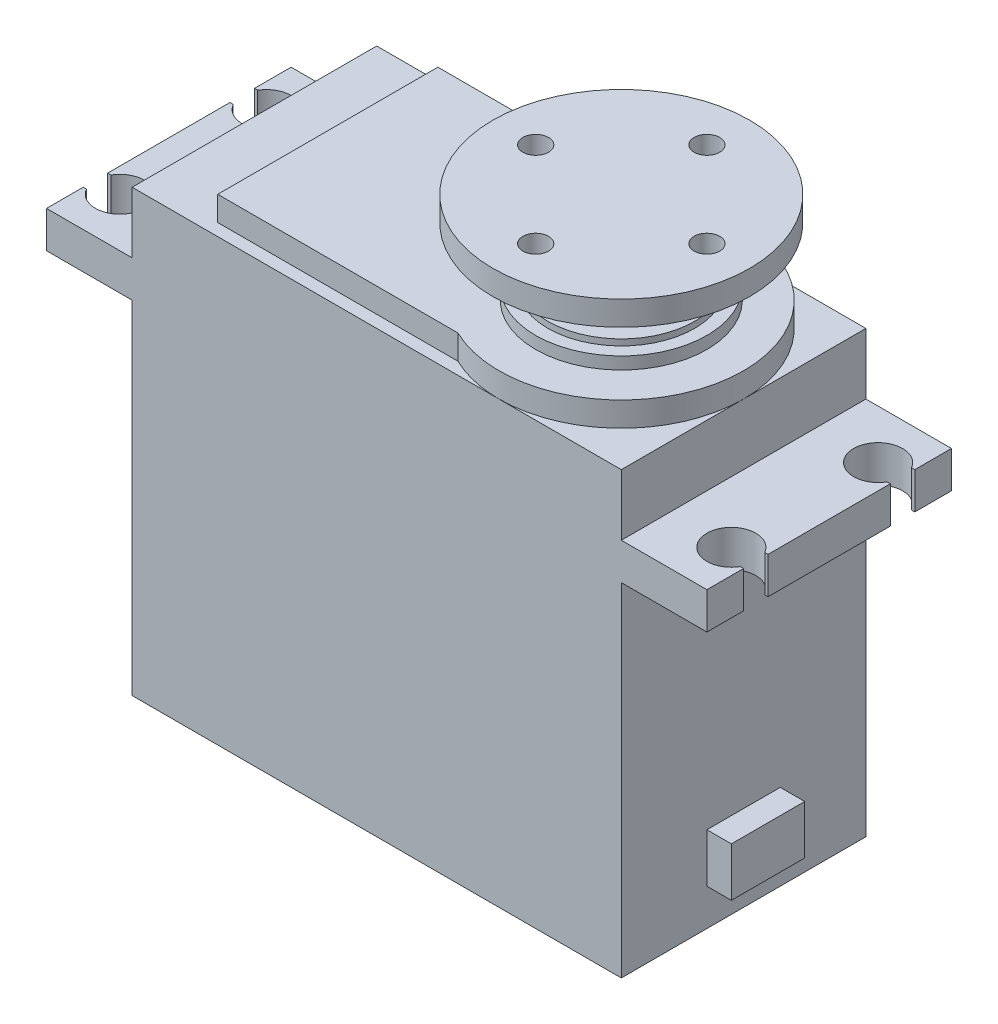
from build123d import *

# Parameters (mm, degrees)
SKETCH1_W           = 40
SKETCH1_H           = 36
BOSS_EXTRUDE1_DEPTH = 20
BOSS_EXTRUDE3_DEPTH = 2
SKETCH4_R           = 7
BOSS_EXTRUDE4_DEPTH = 1
SKETCH5_R           = 6
BOSS_EXTRUDE5_DEPTH = 0.5
SKETCH8_R           = 4.5
BOSS_EXTRUDE6_DEPTH = 4
SKETCH9_R           = 10.5
BOSS_EXTRUDE7_DEPTH = 2
SKETCH13_W          = 7
SKETCH13_H          = 3
BOSS_EXTRUDE8_DEPTH = 20
CUT_EXTRUDE1_DEPTH  = 3
SKETCH17_W          = 6
SKETCH17_H          = 4
BOSS_EXTRUDE9_DEPTH = 2
SKETCH19_R          = 1.05
CUT_EXTRUDE2_DEPTH  = 2


with BuildPart() as part:
    # Sketch1 → Boss-Extrude1 (new body)
    with BuildSketch(Plane.XY):
        Rectangle(SKETCH1_W, SKETCH1_H)
    extrude(amount=BOSS_EXTRUDE1_DEPTH)

    # Sketch2 → Boss-Extrude3 (add)
    with BuildSketch(Plane(origin=(0, 18, 0), x_dir=(1, 0, 0), z_dir=(0, 1, 0))):
        with BuildLine():
            Line((-14, -1), (5.641101056, -1))
            ThreePointArc((5.641101056, -1), (20, -10), (5.641101056, -19))
            Line((5.641101056, -19), (-14, -19))
            Line((-14, -19), (-14, -1))
        make_face()
    extrude(amount=BOSS_EXTRUDE3_DEPTH)

    # Sketch4 → Boss-Extrude4 (add)
    with BuildSketch(Plane(origin=(0, 20, 0), x_dir=(1, 0, 0), z_dir=(0, 1, 0))):
        with Locations(Location((10, -10, 0), (0, 0, 270))):
            Circle(SKETCH4_R)
    extrude(amount=BOSS_EXTRUDE4_DEPTH)

    # Sketch5 → Boss-Extrude5 (add)
    with BuildSketch(Plane(origin=(0, 21, 0), x_dir=(1, 0, 0), z_dir=(0, 1, 0))):
        with Locations(Location((10, -10, 0), (0, 0, 270))):
            Circle(SKETCH5_R)
    extrude(amount=BOSS_EXTRUDE5_DEPTH)

    # Sketch8 → Boss-Extrude6 (add)
    with BuildSketch(Plane(origin=(0, 21.5, 0), x_dir=(1, 0, 0), z_dir=(0, 1, 0))):
        with Locations(Location((10, -10, 0), (0, 0, 270))):
            Circle(SKETCH8_R)
    extrude(amount=BOSS_EXTRUDE6_DEPTH)

    # Sketch9 → Boss-Extrude7 (add)
    with BuildSketch(Plane(origin=(0, 25.5, 0), x_dir=(1, 0, 0), z_dir=(0, 1, 0))):
        with Locations(Location((10, -10, 0), (0, 0, 270))):
            Circle(SKETCH9_R)
    extrude(amount=BOSS_EXTRUDE7_DEPTH)

    # Sketch13 → Boss-Extrude8 (add)
    with BuildSketch(Plane(origin=(0, 0, 0), x_dir=(-1, 0, 0), z_dir=(0, 0, -1))):
        with Locations((23.5, 11.5)):
            Rectangle(SKETCH13_W, SKETCH13_H)
        with Locations((-23.5, 11.5)):
            Rectangle(SKETCH13_W, SKETCH13_H)
    extrude(amount=-BOSS_EXTRUDE8_DEPTH)

    # Sketch14 → Cut-Extrude1 (cut)
    with BuildSketch(Plane(origin=(0, 13, 0), x_dir=(1, 0, 0), z_dir=(0, 1, 0))):
        with BuildLine():
            Line((-27, -17), (-27, -15))
            Line((-27, -15), (-26.732050808, -15))
            ThreePointArc((-26.732050808, -15), (-23, -16), (-26.732050808, -17))
            Line((-26.732050808, -17), (-27, -17))
        make_face()
        with BuildLine():
            Line((-27, -3), (-26.732050808, -3))
            ThreePointArc((-26.732050808, -3), (-23, -4), (-26.732050808, -5))
            Line((-26.732050808, -5), (-27, -5))
            Line((-27, -5), (-27, -3))
        make_face()
    cut_extrude1 = extrude(amount=-CUT_EXTRUDE1_DEPTH, mode=Mode.SUBTRACT)

    # Mirror2: Cut-Extrude1 across plane
    add(cut_extrude1.mirror(Plane(origin=(0, 0, 0), x_dir=(0, 0, 1), z_dir=(1, 0, 0))), mode=Mode.SUBTRACT)

    # Sketch17 → Boss-Extrude9 (add)
    with BuildSketch(Plane(origin=(20, 0, 0), x_dir=(0, 0, -1), z_dir=(1, 0, 0))):
        with Locations((-10, -13)):
            Rectangle(SKETCH17_W, SKETCH17_H)
    extrude(amount=BOSS_EXTRUDE9_DEPTH)

    # Sketch19 → Cut-Extrude2 (cut)
    with BuildSketch(Plane(origin=(0, 27.5, 0), x_dir=(1, 0, 0), z_dir=(0, 1, 0))):
        with Locations(Location((10, -3, 0), (0, 0, 270))):
            Circle(SKETCH19_R)
        with Locations(Location((3, -10, 0), (0, 0, 270))):
            Circle(SKETCH19_R)
        with Locations(Location((10, -17, 0), (0, 0, 90))):
            Circle(SKETCH19_R)
        with Locations(Location((17, -10, 0), (0, 0, 90))):
            Circle(SKETCH19_R)
    extrude(amount=-CUT_EXTRUDE2_DEPTH, mode=Mode.SUBTRACT)


solid = part.part
